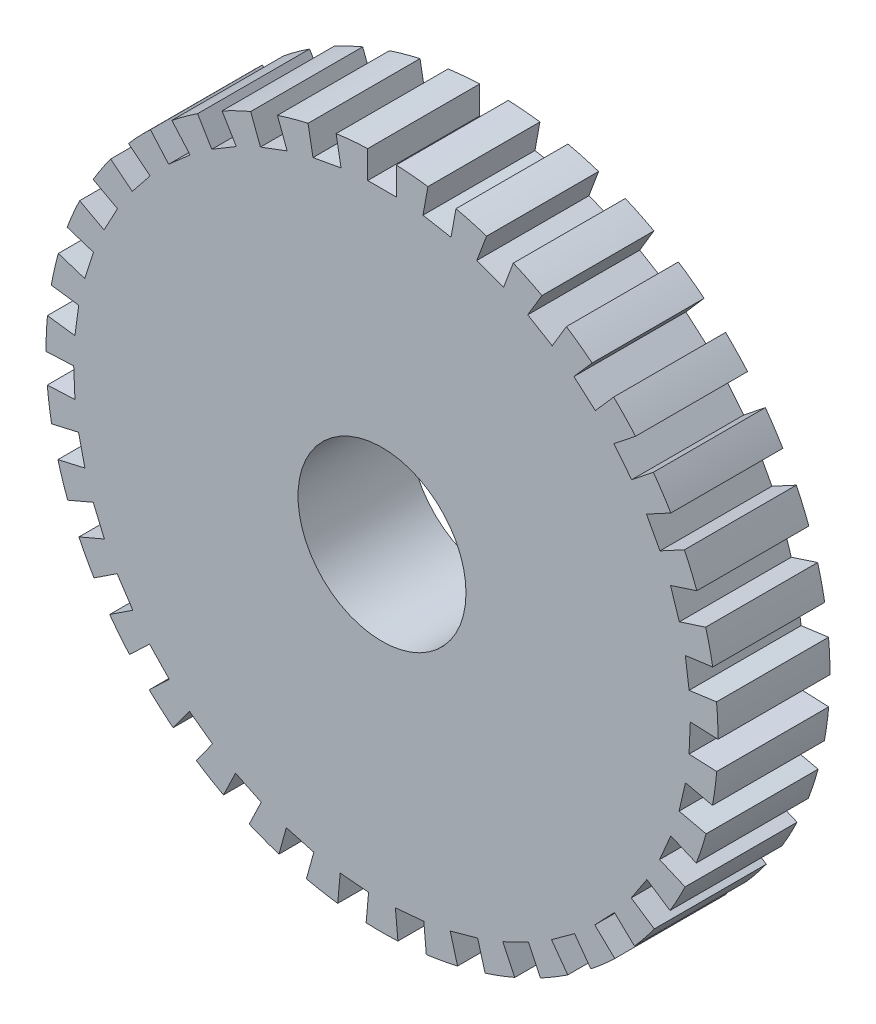
from build123d import *

# Parameters (mm, degrees)
SKETCH1_R           = 6
BOSS_EXTRUDE1_DEPTH = 2
SKETCH2_W           = 0.509324766
SKETCH2_H           = 0.66747415
CUT_EXTRUDE3_DEPTH  = 2
SKETCH3_R           = 1.5
CUT_EXTRUDE4_DEPTH  = 2


with BuildPart() as part:
    # Sketch1 → Boss-Extrude1 (new body)
    with BuildSketch(Plane.XY):
        Circle(SKETCH1_R)
    extrude(amount=BOSS_EXTRUDE1_DEPTH)

    # Sketch2 → Cut-Extrude3 (cut)
    with BuildSketch(Plane.XY.offset(2)):
        with Locations((0, 5.833737075)):
            Rectangle(SKETCH2_W, SKETCH2_H)
        Polygon((1.232632775, 5.366141013), (1.351814887, 6.022888578), (0.850675179, 6.113832027), (0.731493067, 5.457084462), align=None)
        Polygon((2.170985336, 5.059809838), (2.405518948, 5.684722413), (1.928671341, 5.863686313), (1.694137729, 5.238773739), align=None)
        Polygon((3.039560641, 4.590852212), (3.38190765, 5.163844591), (2.944678419, 5.425076896), (2.60233141, 4.852084517), align=None)
        Polygon((3.810441967, 3.974340819), (4.249599059, 4.476996555), (3.86604111, 4.812101043), (3.426884018, 4.309445307), align=None)
        Polygon((4.458852552, 3.230090842), (4.980704856, 3.646254167), (4.663146059, 4.044460304), (4.141293755, 3.628296979), align=None)
        Polygon((4.963951948, 2.382023087), (5.551726702, 2.698318169), (5.310373656, 3.146827283), (4.722598902, 2.8305322), align=None)
        Polygon((5.309505844, 1.45739515), (5.944311483, 1.663656006), (5.786921475, 2.148052644), (5.152115835, 1.941791788), align=None)
        Polygon((5.484407853, 0.485925334), (6.145841203, 0.575522569), (6.077472876, 1.080237825), (5.416039526, 0.99064059), align=None)
        Polygon((5.483036481, -0.501162522), (6.149838529, -0.531108637), (6.172689298, -0.022296726), (5.505887251, 0.007649388), align=None)
        Polygon((5.305435806, -1.472142602), (5.956174985, -1.620669574), (6.069510408, -1.124114642), (5.418771228, -0.975587671), align=None)
        Polygon((4.957314058, -2.395806808), (5.571075076, -2.658140857), (5.771252458, -2.189802589), (5.15749144, -1.92746854), align=None)
        Polygon((4.449860157, -3.242467812), (5.00691623, -3.610177306), (5.287501707, -3.185108478), (4.730445634, -2.817398984), align=None)
        Polygon((3.79938409, -3.984913232), (4.281830977, -4.446179686), (4.633806299, -4.078042361), (4.151359412, -3.616775907), align=None)
        Polygon((3.026792692, -4.599280262), (3.419124153, -5.139278193), (3.831176545, -4.839904606), (3.438845083, -4.299906676), align=None)
        Polygon((2.156917686, -5.065822641), (2.446523866, -5.66719607), (2.905409624, -5.446208335), (2.615803444, -4.844834906), align=None)
        Polygon((1.217717571, -5.369545311), (1.395290288, -6.012965602), (1.886260447, -5.877466447), (1.70868773, -5.234046157), align=None)
        Polygon((0.239379012, -5.500686377), (0.299210933, -6.165473472), (0.806485308, -6.119817952), (0.746653386, -5.455030857), align=None)
        Polygon((-0.746653386, -5.455030857), (-0.806485308, -6.119817952), (-0.299210933, -6.165473472), (-0.239379012, -5.500686377), align=None)
        Polygon((-1.70868773, -5.234046157), (-1.886260447, -5.877466447), (-1.395290288, -6.012965602), (-1.217717571, -5.369545311), align=None)
        Polygon((-2.615803444, -4.844834906), (-2.905409624, -5.446208335), (-2.446523866, -5.667196069), (-2.156917686, -5.065822641), align=None)
        Polygon((-3.438845083, -4.299906676), (-3.831176545, -4.839904606), (-3.419124153, -5.139278193), (-3.026792692, -4.599280262), align=None)
        Polygon((-4.151359412, -3.616775907), (-4.633806299, -4.078042361), (-4.281830977, -4.446179686), (-3.79938409, -3.984913232), align=None)
        Polygon((-4.730445634, -2.817398984), (-5.287501707, -3.185108478), (-5.00691623, -3.610177306), (-4.449860157, -3.242467812), align=None)
        Polygon((-5.15749144, -1.92746854), (-5.771252458, -2.189802589), (-5.571075076, -2.658140857), (-4.957314058, -2.395806808), align=None)
        Polygon((-5.418771228, -0.975587671), (-6.069510408, -1.124114642), (-5.956174985, -1.620669574), (-5.305435806, -1.472142602), align=None)
        Polygon((-5.505887251, 0.007649388), (-6.172689298, -0.022296726), (-6.149838529, -0.531108637), (-5.483036481, -0.501162522), align=None)
        Polygon((-5.416039526, 0.99064059), (-6.077472876, 1.080237825), (-6.145841203, 0.575522569), (-5.484407853, 0.485925334), align=None)
        Polygon((-5.152115835, 1.941791788), (-5.786921475, 2.148052644), (-5.944311483, 1.663656006), (-5.309505844, 1.45739515), align=None)
        Polygon((-4.722598902, 2.8305322), (-5.310373656, 3.146827283), (-5.551726702, 2.698318169), (-4.963951948, 2.382023087), align=None)
        Polygon((-4.141293755, 3.628296979), (-4.663146059, 4.044460304), (-4.980704856, 3.646254167), (-4.458852552, 3.230090842), align=None)
        Polygon((-3.426884018, 4.309445307), (-3.86604111, 4.812101043), (-4.249599059, 4.476996555), (-3.810441967, 3.974340819), align=None)
        Polygon((-2.60233141, 4.852084517), (-2.944678419, 5.425076896), (-3.38190765, 5.163844591), (-3.039560641, 4.590852212), align=None)
        Polygon((-1.694137729, 5.238773739), (-1.928671341, 5.863686313), (-2.405518948, 5.684722413), (-2.170985336, 5.059809838), align=None)
        Polygon((-0.731493067, 5.457084462), (-0.850675179, 6.113832027), (-1.351814887, 6.022888578), (-1.232632775, 5.366141013), align=None)
    extrude(amount=-CUT_EXTRUDE3_DEPTH, mode=Mode.SUBTRACT)

    # Sketch3 → Cut-Extrude4 (cut)
    with BuildSketch(Plane.XY.offset(2)):
        Circle(SKETCH3_R)
    extrude(amount=-CUT_EXTRUDE4_DEPTH, mode=Mode.SUBTRACT)


solid = part.part
